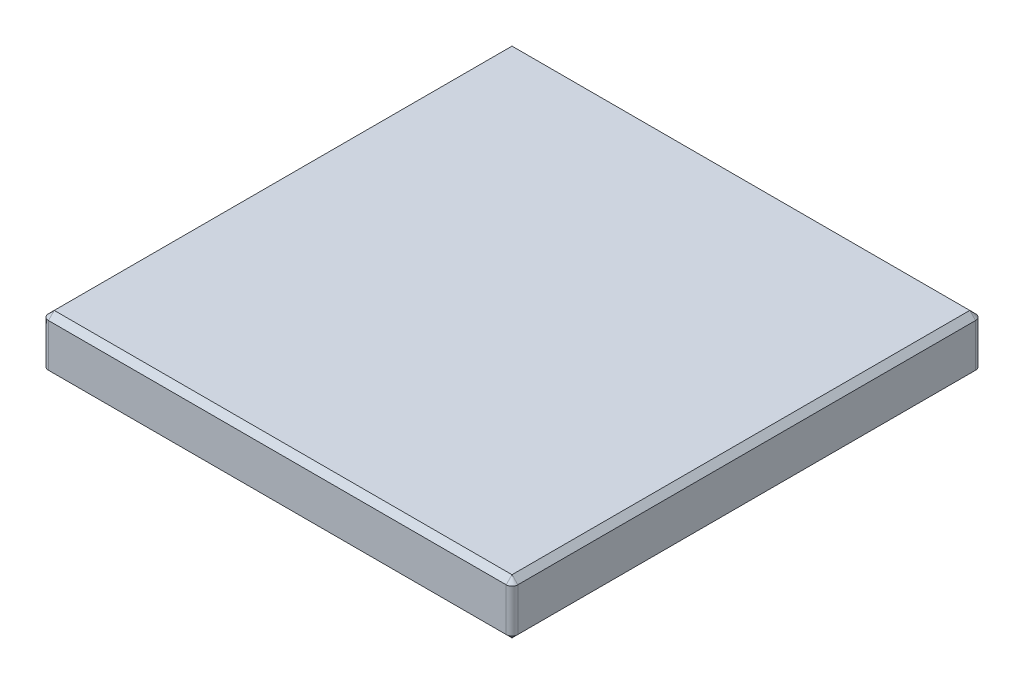
from build123d import *

# Parameters (mm, degrees)
SKETCH1_W           = 403
SKETCH1_H           = 403
BOSS_EXTRUDE1_DEPTH = 47
FILLET1_R           = 5
CHAMFER1_SIZE       = 5


with BuildPart() as part:
    # Sketch1 → Boss-Extrude1 (new body)
    with BuildSketch(Plane(origin=(0, 0, 0), x_dir=(1, 0, 0), z_dir=(0, 1, 0))):
        Rectangle(SKETCH1_W, SKETCH1_H)
    extrude(amount=BOSS_EXTRUDE1_DEPTH)

    # Fillet1
    fillet1_edges = [part.edges().sort_by_distance(p)[0] for p in [
        (201.5, 23.5, 201.5),
        (-201.5, 23.5, 201.5),
        (-201.5, 23.5, -201.5),
        (201.5, 23.5, -201.5),
    ]]
    fillet(fillet1_edges, radius=FILLET1_R)

    # Chamfer1
    chamfer1_edges = [part.edges().sort_by_distance(p)[0] for p in [
        (0, 0, -201.5),
        (0, 47, -201.5),
        (201.5, 0, 0),
        (0, 0, 201.5),
        (-201.5, 0, 0),
        (-200.035533906, 0, 200.035533906),
        (-200.035533906, 0, -200.035533906),
        (200.035533906, 0, 200.035533906),
        (200.035533906, 0, -200.035533906),
        (201.5, 47, 0),
        (-201.5, 47, 0),
        (0, 47, 201.5),
        (-200.035533906, 47, 200.035533906),
        (-200.035533906, 47, -200.035533906),
        (200.035533906, 47, 200.035533906),
        (200.035533906, 47, -200.035533906),
    ]]
    chamfer(chamfer1_edges, length=CHAMFER1_SIZE)


solid = part.part
